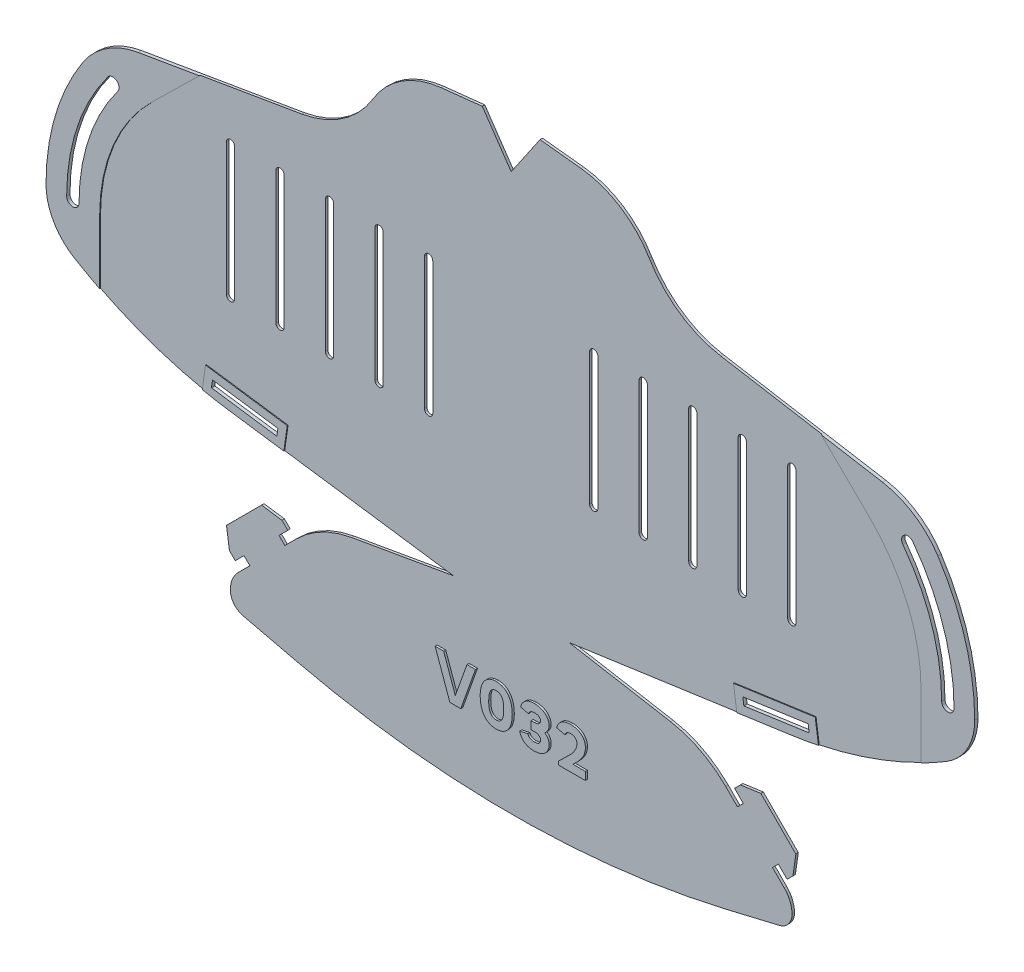
from build123d import *

# Parameters (mm, degrees)
MAIN_SHAPE_DEPTH                   = 0.6
ELASTIC_ATTACHMENT_POINTS_DEPTH    = 184.525502315
REINFORCED_ATTACHMENT_POINTS_DEPTH = 0.2
TAB_SLITS_DEPTH                    = 184.525502315
REINFORCED_TAB_SLITS_DEPTH         = 0.2
BREATHING_SLITS_DEPTH              = 184.525502315
VERSION_NUMBER_DEPTH               = 0.5


with BuildPart() as part:
    # Sketch1 → Main Shape (new body)
    with BuildSketch(Plane.XY):
        with BuildLine():
            Line((0, -10.235233266), (-7, 0))
            Line((-7, 0), (-16.941855461, -1.076805455))
            ThreePointArc((-16.941855461, -1.076805455), (-26.448172688, -4.42923559), (-33.461443341, -11.669600897))
            ThreePointArc((-33.461443341, -11.669600897), (-40.804108255, -19.481824954), (-50.74391922, -23.5))
            Line((-50.74391922, -23.5), (-90.180351554, -30.190874742))
            ThreePointArc((-90.180351554, -30.190874742), (-97.811505455, -33.190405434), (-103.597722286, -39))
            ThreePointArc((-103.597722286, -39), (-110.227482046, -53.35351039), (-112.5, -69))
            ThreePointArc((-112.5, -69), (-110.685143325, -75.893640703), (-105.711102551, -81))
            ThreePointArc((-105.711102551, -81), (-87.655491519, -89.524485559), (-68.266232563, -94.291935705))
            Line((-68.266232563, -94.291935705), (-14, -102))
            Line((-14, -102), (-38.626554922, -106.304973016))
            ThreePointArc((-38.626554922, -106.304973016), (-45.849449199, -108.748014338), (-52, -113.254607005))
            Line((-52, -113.254607005), (-54.828307349, -116.0831539))
            Line((-54.828307349, -116.0831539), (-56.242580797, -114.669000226))
            Line((-56.242580797, -114.669000226), (-54.121350285, -112.547590054))
            Line((-54.121350285, -112.547590054), (-55.535623732, -111.13343638))
            Line((-55.535623732, -111.13343638), (-60.48540114, -110.426539202))
            Line((-60.48540114, -110.426539202), (-68.970323187, -118.912179887))
            Line((-68.970323187, -118.912179887), (-68.263006804, -123.861897408))
            Line((-68.263006804, -123.861897408), (-66.848733357, -125.276051082))
            Line((-66.848733357, -125.276051082), (-64.727502845, -123.154640911))
            Line((-64.727502845, -123.154640911), (-63.313229397, -124.568794586))
            Line((-63.313229397, -124.568794586), (-66.141536747, -127.397341481))
            ThreePointArc((-66.141536747, -127.397341481), (-67.550417669, -129.506025763), (-68.045148042, -131.993340924))
            ThreePointArc((-68.045148042, -131.993340924), (-67.183295285, -134.473669911), (-64.9691321, -135.885159709))
            Line((-64.9691321, -135.885159709), (-52.436095294, -138.860716087))
            ThreePointArc((-52.436095294, -138.860716087), (-26.397134772, -143.459954927), (0, -145))
            ThreePointArc((0, -145), (26.397134772, -143.459954927), (52.436095294, -138.860716087))
            Line((52.436095294, -138.860716087), (64.9691321, -135.885159709))
            ThreePointArc((64.9691321, -135.885159709), (67.183295285, -134.473669911), (68.045148042, -131.993340924))
            ThreePointArc((68.045148042, -131.993340924), (67.550417669, -129.506025763), (66.141536747, -127.397341481))
            Line((66.141536747, -127.397341481), (63.313229397, -124.568794586))
            Line((63.313229397, -124.568794586), (64.727502845, -123.154640911))
            Line((64.727502845, -123.154640911), (66.848733357, -125.276051082))
            Line((66.848733357, -125.276051082), (68.263006804, -123.861897408))
            Line((68.263006804, -123.861897408), (68.970323187, -118.912179887))
            Line((68.970323187, -118.912179887), (60.48540114, -110.426539202))
            Line((60.48540114, -110.426539202), (55.535623732, -111.13343638))
            Line((55.535623732, -111.13343638), (54.121350285, -112.547590054))
            Line((54.121350285, -112.547590054), (56.242580797, -114.669000226))
            Line((56.242580797, -114.669000226), (54.828307349, -116.0831539))
            Line((54.828307349, -116.0831539), (52, -113.254607005))
            ThreePointArc((52, -113.254607005), (45.849449199, -108.748014338), (38.626554922, -106.304973016))
            Line((38.626554922, -106.304973016), (14, -102))
            Line((14, -102), (68.266232563, -94.291935705))
            ThreePointArc((68.266232563, -94.291935705), (87.655491519, -89.524485559), (105.711102551, -81))
            ThreePointArc((105.711102551, -81), (110.685143325, -75.893640703), (112.5, -69))
            ThreePointArc((112.5, -69), (110.227482046, -53.35351039), (103.597722286, -39))
            ThreePointArc((103.597722286, -39), (97.811505455, -33.190405434), (90.180351554, -30.190874742))
            Line((90.180351554, -30.190874742), (50.74391922, -23.5))
            ThreePointArc((50.74391922, -23.5), (40.804108255, -19.481824954), (33.461443341, -11.669600897))
            ThreePointArc((33.461443341, -11.669600897), (26.448172688, -4.42923559), (16.941855461, -1.076805455))
            Line((16.941855461, -1.076805455), (7, 0))
            Line((7, 0), (0, -10.235233266))
        make_face()
    extrude(amount=MAIN_SHAPE_DEPTH)

    # Sketch2 → Elastic Attachment Points (cut, through all)
    with BuildSketch(Plane.XY.offset(0.6)):
        with BuildLine():
            ThreePointArc((-97.5, -39), (-104.934164903, -53.188611699), (-107.5, -69))
            ThreePointArc((-107.5, -69), (-106, -70.5), (-104.5, -69))
            ThreePointArc((-104.5, -69), (-102.088115008, -54.137294997), (-95.1, -40.8))
            ThreePointArc((-95.1, -40.8), (-95.4, -38.7), (-97.5, -39))
        make_face()
        with BuildLine():
            ThreePointArc((97.5, -39), (104.934164903, -53.188611699), (107.5, -69))
            ThreePointArc((107.5, -69), (106, -70.5), (104.5, -69))
            ThreePointArc((104.5, -69), (102.088115008, -54.137294997), (95.1, -40.8))
            ThreePointArc((95.1, -40.8), (95.4, -38.7), (97.5, -39))
        make_face()
    extrude(amount=-ELASTIC_ATTACHMENT_POINTS_DEPTH, mode=Mode.SUBTRACT)

    # Sketch7 → Reinforced Attachment Points (add)
    # profile 1 of 2: a face of its own
    with BuildSketch(Plane.XY.offset(0.6)):
        with BuildLine():
            Line((-99.5, -69), (-99.5, -84.438405623))
            ThreePointArc((-99.5, -84.438405623), (-102.636073846, -82.774338486), (-105.711102551, -81))
            ThreePointArc((-105.711102551, -81), (-110.685143325, -75.893640703), (-112.5, -69))
            ThreePointArc((-112.5, -69), (-110.227482046, -53.35351039), (-103.597722286, -39))
            ThreePointArc((-103.597722286, -39), (-97.811505455, -33.190405434), (-90.180351554, -30.190874742))
            Line((-90.180351554, -30.190874742), (-75.331937335, -27.671659038))
            Line((-75.331937335, -27.671659038), (-86.893876913, -39))
            ThreePointArc((-86.893876913, -39), (-96.22042633, -52.729517991), (-99.5, -69))
        make_face()
        with BuildLine():
            ThreePointArc((-107.5, -69), (-106, -70.5), (-104.5, -69))
            ThreePointArc((-104.5, -69), (-102.088115008, -54.137294997), (-95.1, -40.8))
            ThreePointArc((-95.1, -40.8), (-95.4, -38.7), (-97.5, -39))
            ThreePointArc((-97.5, -39), (-104.934164903, -53.188611699), (-107.5, -69))
        make_face(mode=Mode.SUBTRACT)
    # profile 2 of 2: a face of its own
    with BuildSketch(Plane.XY.offset(0.6)):
        with BuildLine():
            Line((75.331937335, -27.671659038), (90.180351554, -30.190874742))
            ThreePointArc((90.180351554, -30.190874742), (97.811505455, -33.190405434), (103.597722286, -39))
            ThreePointArc((103.597722286, -39), (110.227482046, -53.35351039), (112.5, -69))
            ThreePointArc((112.5, -69), (110.685143325, -75.893640703), (105.711102551, -81))
            ThreePointArc((105.711102551, -81), (102.636073846, -82.774338486), (99.5, -84.438405623))
            Line((99.5, -84.438405623), (99.5, -69))
            ThreePointArc((99.5, -69), (96.22042633, -52.729517991), (86.893876913, -39))
            Line((86.893876913, -39), (75.331937335, -27.671659038))
        make_face()
        with BuildLine():
            ThreePointArc((104.5, -69), (106, -70.5), (107.5, -69))
            ThreePointArc((107.5, -69), (104.934164903, -53.188611699), (97.5, -39))
            ThreePointArc((97.5, -39), (95.4, -38.7), (95.1, -40.8))
            ThreePointArc((95.1, -40.8), (102.088115008, -54.137294997), (104.5, -69))
        make_face(mode=Mode.SUBTRACT)
    extrude(amount=REINFORCED_ATTACHMENT_POINTS_DEPTH)

    # Sketch6 → Tab Slits (cut, through all)
    with BuildSketch(Plane.XY.offset(0.6)):
        Polygon((-72.40962795, -91.683325985), (-56.568632523, -93.933406845), (-56.315498426, -92.151294859), (-72.156493853, -89.901213999), align=None)
        Polygon((72.40962795, -91.683325985), (72.156493853, -89.901213999), (56.315498426, -92.151294859), (56.568632523, -93.933406845), align=None)
    extrude(amount=-TAB_SLITS_DEPTH, mode=Mode.SUBTRACT)

    # Sketch9 → Reinforced Tab Slits (add)
    # profile 1 of 2: a face of its own
    with BuildSketch(Plane.XY.offset(0.6)):
        with BuildLine():
            Line((-54.869768202, -96.194791381), (-54.05411389, -90.452430538))
            Line((-54.05411389, -90.452430538), (-73.855358174, -87.639829463))
            Line((-73.855358174, -87.639829463), (-74.64155561, -93.174808322))
            ThreePointArc((-74.64155561, -93.174808322), (-71.462934655, -93.784965542), (-68.266232563, -94.291935705))
            Line((-68.266232563, -94.291935705), (-54.869768202, -96.194791381))
        make_face()
        Polygon((-56.568632523, -93.933406845), (-56.315498426, -92.151294859), (-72.156493853, -89.901213999), (-72.40962795, -91.683325985), align=None, mode=Mode.SUBTRACT)
    # profile 2 of 2: a face of its own
    with BuildSketch(Plane.XY.offset(0.6)):
        with BuildLine():
            Line((68.266232563, -94.291935705), (54.869768202, -96.194791381))
            Line((54.869768202, -96.194791381), (54.05411389, -90.452430538))
            Line((54.05411389, -90.452430538), (73.855358174, -87.639829463))
            Line((73.855358174, -87.639829463), (74.64155561, -93.174808322))
            ThreePointArc((74.64155561, -93.174808322), (71.462934655, -93.784965542), (68.266232563, -94.291935705))
        make_face()
        Polygon((56.315498426, -92.151294859), (72.156493853, -89.901213999), (72.40962795, -91.683325985), (56.568632523, -93.933406845), align=None, mode=Mode.SUBTRACT)
    extrude(amount=REINFORCED_TAB_SLITS_DEPTH)

    # Sketch3 → Breathing Slits (cut, through all)
    with BuildSketch(Plane.XY.offset(0.6)):
        with BuildLine():
            Line((-19, -38.45), (-19, -70.45))
            ThreePointArc((-19, -70.45), (-20, -71.45), (-21, -70.45))
            Line((-21, -70.45), (-21, -38.45))
            ThreePointArc((-21, -38.45), (-20, -37.45), (-19, -38.45))
        make_face()
        with BuildLine():
            Line((-31, -38.45), (-31, -70.45))
            ThreePointArc((-31, -70.45), (-32, -71.45), (-33, -70.45))
            Line((-33, -70.45), (-33, -38.45))
            ThreePointArc((-33, -38.45), (-32, -37.45), (-31, -38.45))
        make_face()
        with BuildLine():
            Line((-43, -38.45), (-43, -70.45))
            ThreePointArc((-43, -70.45), (-44, -71.45), (-45, -70.45))
            Line((-45, -70.45), (-45, -38.45))
            ThreePointArc((-45, -38.45), (-44, -37.45), (-43, -38.45))
        make_face()
        with BuildLine():
            Line((-55, -38.45), (-55, -70.45))
            ThreePointArc((-55, -70.45), (-56, -71.45), (-57, -70.45))
            Line((-57, -70.45), (-57, -38.45))
            ThreePointArc((-57, -38.45), (-56, -37.45), (-55, -38.45))
        make_face()
        with BuildLine():
            Line((-67, -38.45), (-67, -70.45))
            ThreePointArc((-67, -70.45), (-68, -71.45), (-69, -70.45))
            Line((-69, -70.45), (-69, -38.45))
            ThreePointArc((-69, -38.45), (-68, -37.45), (-67, -38.45))
        make_face()
        with BuildLine():
            Line((19, -38.45), (19, -70.45))
            ThreePointArc((19, -70.45), (20, -71.45), (21, -70.45))
            Line((21, -70.45), (21, -38.45))
            ThreePointArc((21, -38.45), (20, -37.45), (19, -38.45))
        make_face()
        with BuildLine():
            Line((31, -38.45), (31, -70.45))
            ThreePointArc((31, -70.45), (32, -71.45), (33, -70.45))
            Line((33, -70.45), (33, -38.45))
            ThreePointArc((33, -38.45), (32, -37.45), (31, -38.45))
        make_face()
        with BuildLine():
            Line((43, -38.45), (43, -70.45))
            ThreePointArc((43, -70.45), (44, -71.45), (45, -70.45))
            Line((45, -70.45), (45, -38.45))
            ThreePointArc((45, -38.45), (44, -37.45), (43, -38.45))
        make_face()
        with BuildLine():
            Line((55, -38.45), (55, -70.45))
            ThreePointArc((55, -70.45), (56, -71.45), (57, -70.45))
            Line((57, -70.45), (57, -38.45))
            ThreePointArc((57, -38.45), (56, -37.45), (55, -38.45))
        make_face()
        with BuildLine():
            Line((67, -38.45), (67, -70.45))
            ThreePointArc((67, -70.45), (68, -71.45), (69, -70.45))
            Line((69, -70.45), (69, -38.45))
            ThreePointArc((69, -38.45), (68, -37.45), (67, -38.45))
        make_face()
    extrude(amount=-BREATHING_SLITS_DEPTH, mode=Mode.SUBTRACT)

    # Sketch8 → Version Number (add)
    # profile 1 of 4: a face of its own
    with BuildSketch(Plane.XY.offset(0.6)):
        Polygon((-14.353036684, -128.5), (-11.718116049, -128.5), (-8.146687478, -118.5), (-10.210179541, -118.5), (-13.035576367, -126.420634921), (-15.860973192, -118.5), (-17.924465256, -118.5), align=None)
    # profile 2 of 4: a face of its own
    with BuildSketch(Plane.XY.offset(0.6)):
        with BuildLine():
            add(Edge.make_bspline(
                [(-3.124512798, -118.5), (-3.268878762, -118.505695671), (-3.55163391, -118.51685121), (-3.964768911, -118.5745591), (-4.352611614, -118.680335178), (-4.71981319, -118.819656178), (-5.062088761, -119.003303471), (-5.385881936, -119.221085059), (-5.678892551, -119.487440084), (-5.954347604, -119.785519386), (-6.200210785, -120.12453761), (-6.413646494, -120.500892889), (-6.595609271, -120.912503383), (-6.744530434, -121.360169436), (-6.860079483, -121.844506854), (-6.947833422, -122.364485904), (-6.999387861, -122.921030718), (-7.010044591, -123.303893775), (-7.015523173, -123.500722112)],
                knots=[0, 0, 0, 0, 0.970159994, 1.900155169, 2.79438565, 3.665191596, 4.532301255, 5.397946305, 6.279238358, 7.185391655, 8.120220805, 9.085107467, 10.08639026, 11.138349125, 12.249459105, 13.427760297, 14.677622047, 16, 16, 16, 16], degree=3))
            add(Edge.make_bspline(
                [(-7.015523173, -123.500722112), (-7.010099782, -123.69832053), (-6.999591155, -124.081196856), (-6.947624086, -124.637697099), (-6.860178196, -125.156966907), (-6.744068339, -125.641884177), (-6.596125676, -126.090648826), (-6.413579051, -126.502814664), (-6.200268747, -126.879260377), (-5.954187566, -127.218032326), (-5.679795829, -127.51659595), (-5.384328283, -127.779877259), (-5.06297704, -128.000979952), (-4.719619736, -128.183632701), (-4.353066681, -128.324409639), (-3.964113602, -128.425104033), (-3.552335281, -128.488808035), (-3.269553908, -128.496221224), (-3.125409832, -128.5)],
                knots=[0, 0, 0, 0, 1.327400251, 2.57203543, 3.750234214, 4.861247624, 5.917991082, 6.919186852, 7.883989653, 8.818737555, 9.724812096, 10.602616666, 11.47109776, 12.338132057, 13.208862319, 14.101698703, 15.032365954, 16, 16, 16, 16], degree=3))
            add(Edge.make_bspline(
                [(-3.125409832, -128.5), (-2.981270164, -128.496210687), (-2.698497434, -128.488776824), (-2.28665702, -128.425221319), (-1.897234689, -128.323813307), (-1.529873211, -128.184839888), (-1.187483731, -128.000200623), (-0.866437325, -127.779984633), (-0.571038656, -127.516566079), (-0.296628857, -127.218040576), (-0.05054823, -126.879258594), (0.162744512, -126.502813072), (0.345366389, -126.090657611), (0.493004127, -125.641847927), (0.610316977, -125.157235462), (0.692759124, -124.637275213), (0.750415349, -124.081441513), (0.758325717, -123.698369528), (0.762407101, -123.500722112)],
                knots=[0, 0, 0, 0, 0.96765053, 1.898333634, 2.791185227, 3.666728435, 4.529238626, 5.397734515, 6.275554038, 7.181644014, 8.116407839, 9.081227075, 10.082439899, 11.139201358, 12.250233695, 13.427610983, 14.672766316, 16, 16, 16, 16], degree=3))
            add(Edge.make_bspline(
                [(0.762407101, -123.500722112), (0.758266271, -123.303845261), (0.750209566, -122.920787111), (0.692965588, -122.364907693), (0.610217393, -121.844238468), (0.493467757, -121.360205444), (0.344849792, -120.912494629), (0.162811975, -120.500894477), (-0.050606202, -120.124539393), (-0.296468797, -119.785511139), (-0.571942034, -119.487469991), (-0.864883242, -119.220977415), (-1.188368104, -119.004075275), (-1.529679752, -118.818455332), (-1.897690316, -118.680915067), (-2.286006948, -118.574534625), (-2.698856026, -118.516562336), (-2.981340857, -118.506550382), (-3.125409832, -118.501444225)],
                knots=[0, 0, 0, 0, 1.322391154, 2.572941942, 3.750582404, 4.861863084, 5.913983562, 6.915420183, 7.880455081, 8.815427849, 9.721720359, 10.603147806, 11.468925845, 12.331628829, 13.207367743, 14.101735605, 15.031873656, 16, 16, 16, 16], degree=3))
            Line((-3.125409832, -118.501444225), (-3.124512798, -118.5))
        make_face()
        with BuildLine():
            add(Edge.make_bspline(
                [(-3.124512798, -126.579365079), (-3.193832346, -126.580142247), (-3.329842672, -126.581667111), (-3.527295909, -126.549518886), (-3.713747004, -126.50001124), (-3.887924299, -126.424863461), (-4.05171966, -126.32888552), (-4.202335203, -126.207295998), (-4.340694226, -126.063513987), (-4.468009284, -125.896932623), (-4.581880587, -125.703005633), (-4.680411576, -125.478827118), (-4.761148991, -125.222713054), (-4.830325749, -124.937433189), (-4.881577114, -124.621763618), (-4.920080679, -124.276117752), (-4.945947343, -123.899148475), (-4.949306618, -123.63702081), (-4.951053342, -123.500722112)],
                knots=[0, 0, 0, 0, 0.820209436, 1.609314487, 2.362064528, 3.101854642, 3.850272983, 4.605479342, 5.3882482, 6.210255141, 7.084711649, 8.047345167, 9.106040688, 10.263495908, 11.523832392, 12.893430008, 14.384674726, 16, 16, 16, 16], degree=3))
            add(Edge.make_bspline(
                [(-4.951053342, -123.500722112), (-4.949299731, -123.364424703), (-4.945927212, -123.102299516), (-4.920151567, -122.725313211), (-4.881258593, -122.378974061), (-4.830962309, -122.063111109), (-4.760744886, -121.778059679), (-4.680441854, -121.522619394), (-4.581911694, -121.298401339), (-4.467877035, -121.104640769), (-4.341486731, -120.937923887), (-4.201524245, -120.796456824), (-4.051803493, -120.674830172), (-3.887963609, -120.578630118), (-3.713317589, -120.50465551), (-3.527950042, -120.450210023), (-3.329806333, -120.423926373), (-3.19436306, -120.422146526), (-3.125409832, -120.421240419)],
                knots=[0, 0, 0, 0, 1.616177311, 3.108208617, 4.478528655, 5.748482895, 6.897727805, 7.956981757, 8.920123036, 9.795040793, 10.617481319, 11.394165711, 12.149770419, 12.898583529, 13.63876386, 14.394368568, 15.182584207, 16, 16, 16, 16], degree=3))
            add(Edge.make_bspline(
                [(-3.125409832, -120.421240419), (-3.056458197, -120.422149219), (-2.921018053, -120.423934355), (-2.722851832, -120.450179948), (-2.537565245, -120.504762296), (-2.363231898, -120.577982734), (-2.201006563, -120.675595023), (-2.051536805, -120.796360516), (-1.911636558, -120.937948802), (-1.785272246, -121.104645093), (-1.671047509, -121.298351736), (-1.573262228, -121.523063414), (-1.48930237, -121.777554553), (-1.420113271, -122.063195246), (-1.369483592, -122.378948588), (-1.330691478, -122.725320897), (-1.304885814, -123.102297333), (-1.301517662, -123.364423957), (-1.299766323, -123.500722112)],
                knots=[0, 0, 0, 0, 0.817669415, 1.606129616, 2.361968767, 3.102378757, 3.843623451, 4.599462602, 5.376387978, 6.199083685, 7.074272906, 8.037713021, 9.100132017, 10.249733507, 11.520081779, 12.89082699, 14.383321233, 16, 16, 16, 16], degree=3))
            add(Edge.make_bspline(
                [(-1.299766323, -123.500722112), (-1.301510776, -123.637021556), (-1.304865684, -123.899150658), (-1.33076236, -124.276110066), (-1.36916531, -124.621789015), (-1.420748529, -124.937349474), (-1.488890394, -125.223220708), (-1.573291906, -125.478383327), (-1.671078761, -125.703055181), (-1.78513994, -125.896928348), (-1.912429082, -126.063488884), (-2.050725173, -126.207393621), (-2.201089262, -126.328120602), (-2.363270489, -126.425517476), (-2.537135739, -126.499891817), (-2.723505077, -126.549600883), (-2.920694706, -126.581404352), (-3.056393241, -126.580608552), (-3.125409832, -126.580203806)],
                knots=[0, 0, 0, 0, 1.616177474, 3.108208932, 4.478529109, 5.739530511, 6.897596372, 7.959685938, 8.922827315, 9.797745161, 10.620185771, 11.403367596, 12.15897238, 12.899987232, 13.640167639, 14.39331481, 15.182836171, 16, 16, 16, 16], degree=3))
            Line((-3.125409832, -126.580203806), (-3.124512798, -126.579365079))
        make_face(mode=Mode.SUBTRACT)
    # profile 3 of 4: a face of its own
    with BuildSketch(Plane.XY.offset(0.6)):
        with BuildLine():
            Line((6.198092009, -124.404761905), (6.293330104, -124.404761905))
            add(Edge.make_bspline(
                [(6.293330104, -124.404761905), (6.393597999, -124.411299477), (6.584233201, -124.423729091), (6.850899497, -124.486416557), (7.083693586, -124.578961335), (7.275380964, -124.709274647), (7.429026265, -124.861365804), (7.543353704, -125.032278467), (7.613014948, -125.222537651), (7.621890385, -125.355662585), (7.626367416, -125.422814713)],
                knots=[0, 0, 0, 0, 1.293250512, 2.458803691, 3.516087315, 4.504014474, 5.424976382, 6.287022232, 7.135923681, 8, 8, 8, 8], degree=3))
            add(Edge.make_bspline(
                [(7.626367416, -125.422814713), (7.623077866, -125.504440638), (7.61671688, -125.662280257), (7.547569508, -125.887718235), (7.429214651, -126.087113891), (7.294298814, -126.23073656), (7.165134159, -126.331172702), (7.050245163, -126.395688771), (6.921394263, -126.450185226), (6.778366257, -126.49595932), (6.621644798, -126.532200484), (6.450685861, -126.560253509), (6.264862139, -126.575366879), (6.136023143, -126.5785552), (6.069403517, -126.580203806)],
                knots=[0, 0, 0, 0, 1.334208421, 2.579951764, 3.816761299, 5.103436918, 5.78324123, 6.491044783, 7.25516555, 8.072210043, 8.94833879, 9.888551629, 10.908219533, 12, 12, 12, 12], degree=3))
            add(Edge.make_bspline(
                [(6.069403517, -126.580203806), (5.995009926, -126.579024673), (5.844525333, -126.576639503), (5.617878787, -126.537785365), (5.389603829, -126.472292557), (5.16250643, -126.384048723), (4.948349829, -126.26078738), (4.771027301, -126.088542309), (4.629857545, -125.87591894), (4.575288391, -125.712337396), (4.546885722, -125.62719493)],
                knots=[0, 0, 0, 0, 0.920255672, 1.861508472, 2.836752399, 3.857684402, 4.873720033, 5.872631744, 6.892727297, 8, 8, 8, 8], degree=3))
            Line((4.546885722, -125.62719493), (2.563171374, -126.071428571))
            add(Edge.make_bspline(
                [(2.563171374, -126.071428571), (2.586006658, -126.160336196), (2.630962803, -126.335369884), (2.723971682, -126.586847228), (2.83540912, -126.824009097), (2.960565463, -127.050933458), (3.10871655, -127.26169635), (3.272885089, -127.459934114), (3.452116619, -127.647890635), (3.652448911, -127.819546753), (3.86989589, -127.976110236), (4.107042463, -128.112422888), (4.361607961, -128.230322428), (4.637145351, -128.322934743), (4.929262966, -128.399729339), (5.240531536, -128.45295857), (5.569362514, -128.491934936), (5.795244006, -128.497268097), (5.910951439, -128.5)],
                knots=[0, 0, 0, 0, 0.97897001, 1.927311989, 2.855460552, 3.773345826, 4.68872018, 5.599601379, 6.518067916, 7.456260856, 8.41049365, 9.372940738, 10.370680865, 11.39871829, 12.470472684, 13.590411754, 14.765692276, 16, 16, 16, 16], degree=3))
            add(Edge.make_bspline(
                [(5.910951439, -128.5), (6.067221325, -128.494245394), (6.369747375, -128.483104934), (6.807556164, -128.435865678), (7.213204546, -128.358387224), (7.586979338, -128.252017359), (7.931853032, -128.123277608), (8.242838452, -127.961059217), (8.524929888, -127.774497038), (8.772583909, -127.55815064), (8.986978622, -127.319870658), (9.178736196, -127.071551477), (9.336525488, -126.805353082), (9.469056142, -126.527874631), (9.567683766, -126.234513517), (9.639147469, -125.928607165), (9.680819871, -125.607680152), (9.685937504, -125.38925418), (9.68854084, -125.278141077)],
                knots=[0, 0, 0, 0, 1.338573179, 2.591371041, 3.766159492, 4.869841347, 5.915366975, 6.911991706, 7.866279139, 8.804635322, 9.718527085, 10.607232931, 11.486170613, 12.362759498, 13.235296616, 14.130311397, 15.048891017, 16, 16, 16, 16], degree=3))
            add(Edge.make_bspline(
                [(9.68854084, -125.278141077), (9.683192413, -125.181448476), (9.672665654, -124.991138356), (9.617350068, -124.713321084), (9.52499018, -124.451246621), (9.395798442, -124.20784025), (9.244598736, -123.977552327), (9.06946732, -123.764837772), (8.875070274, -123.566155092), (8.730645608, -123.449574998), (8.657454128, -123.39049458)],
                knots=[0, 0, 0, 0, 1.042147361, 2.051151675, 3.039496243, 4.024119517, 5.012016893, 6.002285516, 6.987598979, 8, 8, 8, 8], degree=3))
            add(Edge.make_bspline(
                [(8.657454128, -123.39049458), (8.730635163, -123.325162044), (8.874995919, -123.19628365), (9.069268042, -122.981710509), (9.243438747, -122.755542958), (9.396794499, -122.515248899), (9.523996024, -122.261642739), (9.616820113, -121.993228321), (9.672728376, -121.711764564), (9.683213764, -121.519933272), (9.68854084, -121.42247384)],
                knots=[0, 0, 0, 0, 1.026734164, 2.025389794, 3.025877614, 4.013273499, 5.006315215, 5.989929209, 6.978788314, 8, 8, 8, 8], degree=3))
            add(Edge.make_bspline(
                [(9.68854084, -121.42247384), (9.684458975, -121.322020203), (9.676439995, -121.124675201), (9.629497298, -120.835115028), (9.554319283, -120.558271626), (9.446877226, -120.294880847), (9.31346163, -120.042407113), (9.148649716, -119.803370965), (8.957620538, -119.574583887), (8.736789679, -119.361344215), (8.490090521, -119.166999953), (8.218282305, -118.995833154), (7.923743615, -118.84746887), (7.602967562, -118.730513446), (7.261051945, -118.632405283), (6.895172109, -118.562780212), (6.506096954, -118.515976725), (6.238708863, -118.506371293), (6.101553214, -118.501444225)],
                knots=[0, 0, 0, 0, 0.933249724, 1.833404674, 2.71837752, 3.592513965, 4.4704886, 5.365912677, 6.284554944, 7.234984132, 8.212272519, 9.196674926, 10.214289296, 11.269589965, 12.363543901, 13.515449053, 14.72555956, 16, 16, 16, 16], degree=3))
            add(Edge.make_bspline(
                [(6.101553214, -118.501444225), (5.988160862, -118.504384419), (5.766980103, -118.510119502), (5.444195833, -118.546209564), (5.138366528, -118.597359567), (4.849547802, -118.671164203), (4.578504245, -118.76520159), (4.324782162, -118.877770477), (4.088252628, -119.009217236), (3.870649359, -119.161041577), (3.670388783, -119.328960798), (3.488991795, -119.510905494), (3.324244802, -119.704452098), (3.179710626, -119.91288512), (3.05008115, -120.132286581), (2.943546121, -120.36651166), (2.848627163, -120.610059019), (2.805222945, -120.780460499), (2.7832452, -120.866743363)],
                knots=[0, 0, 0, 0, 1.229240767, 2.397731417, 3.51786287, 4.588673614, 5.625367482, 6.624717489, 7.594406979, 8.554388623, 9.496885304, 10.424058211, 11.336820069, 12.248524965, 13.170856983, 14.095351914, 15.035580601, 16, 16, 16, 16], degree=3))
            Line((2.7832452, -120.866743363), (4.690155501, -121.373015873))
            add(Edge.make_bspline(
                [(4.690155501, -121.373015873), (4.701453151, -121.326631527), (4.725969327, -121.22597637), (4.816470454, -121.081457089), (4.938319128, -120.927147787), (5.099531903, -120.771324055), (5.296909676, -120.625559671), (5.534999654, -120.514206488), (5.808084041, -120.446844288), (6.000913479, -120.430020784), (6.101553214, -120.421240419)],
                knots=[0, 0, 0, 0, 0.626586808, 1.359708585, 2.222843852, 3.223153095, 4.308434095, 5.447412619, 6.667777482, 8, 8, 8, 8], degree=3))
            add(Edge.make_bspline(
                [(6.101553214, -120.421240419), (6.1735862, -120.423218633), (6.311821689, -120.42701494), (6.509225011, -120.449676308), (6.689516639, -120.474391788), (6.850566044, -120.515621967), (6.996181051, -120.558109891), (7.120790238, -120.618078056), (7.231551572, -120.680273756), (7.34645526, -120.780934624), (7.460783251, -120.912654377), (7.563777203, -121.077310889), (7.623774218, -121.24921056), (7.625513286, -121.365405566), (7.626367416, -121.42247384)],
                knots=[0, 0, 0, 0, 1.26888152, 2.435057415, 3.499383416, 4.470882074, 5.362320585, 6.164854387, 6.902680001, 7.591682225, 8.843898063, 9.963361673, 10.999720905, 12, 12, 12, 12], degree=3))
            add(Edge.make_bspline(
                [(7.626367416, -121.42247384), (7.621296662, -121.49199044), (7.611218464, -121.630155711), (7.535939651, -121.827940252), (7.414414338, -122.008163808), (7.251087592, -122.171288708), (7.043751683, -122.307565764), (6.796214708, -122.408872593), (6.509334374, -122.47003825), (6.305479531, -122.480300003), (6.198002305, -122.485710249)],
                knots=[0, 0, 0, 0, 0.842573162, 1.674626639, 2.532888499, 3.465967991, 4.458251597, 5.524776888, 6.695002246, 8, 8, 8, 8], degree=3))
            Line((6.198002305, -122.485710249), (5.340949152, -122.484126984))
            Line((5.340949152, -122.484126984), (5.340949152, -124.404761905))
            Line((5.340949152, -124.404761905), (6.198092009, -124.404761905))
        make_face()
    # profile 4 of 4: a face of its own
    with BuildSketch(Plane.XY.offset(0.6)):
        with BuildLine():
            Line((18.448978951, -126.579365079), (15.480724983, -126.579365079))
            Line((15.480724983, -126.579365079), (16.480724983, -125.579365079))
            add(Edge.make_bspline(
                [(16.480724983, -125.579365079), (16.623258002, -125.435101948), (16.904512687, -125.150433303), (17.281272668, -124.693877148), (17.621400807, -124.228877799), (17.872007262, -123.829278657), (18.04550508, -123.500008431), (18.15843927, -123.246183665), (18.255245955, -122.984860872), (18.332745009, -122.715154547), (18.395353852, -122.438403207), (18.440454661, -122.153805288), (18.471903881, -121.861768592), (18.476743782, -121.664444299), (18.47918657, -121.56485107)],
                knots=[0, 0, 0, 0, 1.582570997, 3.122823812, 4.615792444, 6.07845684, 6.800172901, 7.519807657, 8.24584061, 8.973961103, 9.709013445, 10.459618703, 11.222541005, 12, 12, 12, 12], degree=3))
            add(Edge.make_bspline(
                [(18.47918657, -121.56485107), (18.475402354, -121.452127389), (18.468004607, -121.231764352), (18.417721279, -120.911326598), (18.343669655, -120.60713083), (18.23385907, -120.321563977), (18.098584864, -120.051733691), (17.93409097, -119.798158257), (17.737813947, -119.564341147), (17.51452569, -119.348254557), (17.266563933, -119.152664175), (16.993827184, -118.982193794), (16.698250561, -118.837069135), (16.380317292, -118.718460118), (16.040320278, -118.622746198), (15.677025045, -118.559191945), (15.292116265, -118.513486883), (15.02782753, -118.505528391), (14.892198944, -118.501444225)],
                knots=[0, 0, 0, 0, 1.019764297, 1.993532827, 2.929308438, 3.84787678, 4.755541458, 5.656627231, 6.576344045, 7.511991459, 8.464008606, 9.428817176, 10.417039143, 11.438566378, 12.495688184, 13.60842439, 14.772683148, 16, 16, 16, 16], degree=3))
            add(Edge.make_bspline(
                [(14.892198944, -118.501444225), (14.776550388, -118.504731189), (14.550181839, -118.511165039), (14.22006676, -118.542535978), (13.908055792, -118.596276475), (13.614145925, -118.665774953), (13.33888903, -118.757886794), (13.082905875, -118.871562794), (12.84373399, -119.001342713), (12.623752457, -119.151574984), (12.424559103, -119.320801377), (12.239491976, -119.500802902), (12.077215107, -119.698408314), (11.927009036, -119.905748922), (11.800344394, -120.130971141), (11.689213195, -120.368710981), (11.596403087, -120.619826819), (11.550985906, -120.794348677), (11.527962791, -120.882818212)],
                knots=[0, 0, 0, 0, 1.237288182, 2.421847195, 3.543086451, 4.621383684, 5.649265595, 6.642689818, 7.613694239, 8.55614632, 9.485995527, 10.406534234, 11.313316084, 12.217506806, 13.141643155, 14.072032899, 15.02266482, 16, 16, 16, 16], degree=3))
            Line((11.527962791, -120.882818212), (13.512471015, -121.373015873))
            add(Edge.make_bspline(
                [(13.512471015, -121.373015873), (13.530131457, -121.313660818), (13.566007253, -121.193085709), (13.660731999, -121.024273028), (13.78838454, -120.866109379), (13.944766698, -120.716952615), (14.136551961, -120.59002378), (14.360902976, -120.494492671), (14.617096311, -120.438465619), (14.797774531, -120.427152683), (14.892198944, -120.421240419)],
                knots=[0, 0, 0, 0, 0.821603693, 1.669023057, 2.553015954, 3.518058165, 4.53170708, 5.594421511, 6.742818376, 8, 8, 8, 8], degree=3))
            add(Edge.make_bspline(
                [(14.892198944, -120.421240419), (15.005870609, -120.426106911), (15.22247777, -120.43538026), (15.527445392, -120.504263654), (15.792364131, -120.616865119), (16.014713601, -120.772700105), (16.191294293, -120.965209606), (16.321914784, -121.190228557), (16.401550566, -121.447139154), (16.411752324, -121.629344082), (16.417013146, -121.723303148)],
                knots=[0, 0, 0, 0, 1.208719883, 2.30327744, 3.306415015, 4.253218101, 5.169797949, 6.063846763, 7.001568439, 8, 8, 8, 8], degree=3))
            add(Edge.make_bspline(
                [(16.417013146, -121.723303148), (16.414388747, -121.841534164), (16.408974023, -122.085471261), (16.331326003, -122.456607682), (16.210725288, -122.843397809), (16.070407917, -123.172040038), (15.933218998, -123.443264128), (15.808214918, -123.651697293), (15.667380025, -123.86351308), (15.510811575, -124.079317691), (15.338408545, -124.300506253), (15.147810225, -124.52439598), (14.941286452, -124.75288648), (14.793330453, -124.901378986), (14.717672017, -124.977311769)],
                knots=[0, 0, 0, 0, 1.128055105, 2.32743062, 3.606916281, 4.996817725, 5.736192845, 6.510253921, 7.317743928, 8.166429697, 9.057590288, 9.997041475, 10.975771781, 12, 12, 12, 12], degree=3))
            Line((14.717672017, -124.977311769), (11.988661491, -127.642857143))
            Line((11.988661491, -127.642857143), (11.988661491, -128.5))
            Line((11.988661491, -128.5), (18.448978951, -128.5))
            Line((18.448978951, -128.5), (18.448978951, -126.579365079))
        make_face()
    extrude(amount=VERSION_NUMBER_DEPTH)


solid = part.part
